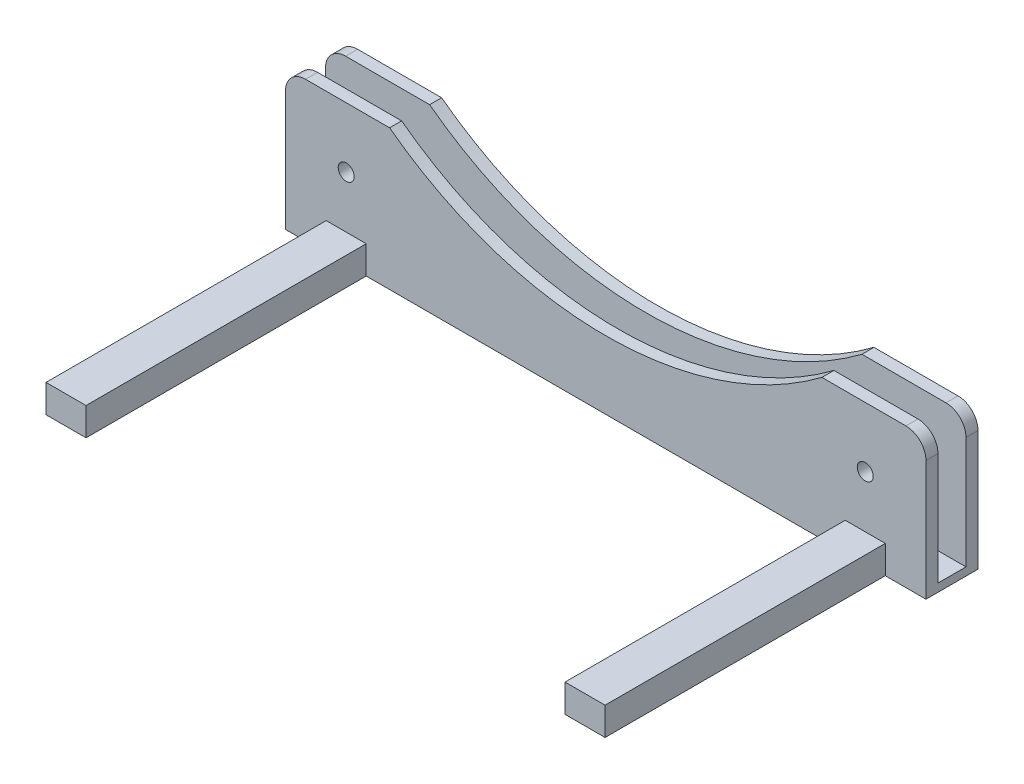
from build123d import *

# Parameters (mm, degrees)
SKETCH_1_R          = 2
EXTRUDE_1_DEPTH     = 13
SKETCH_2_W          = 7
SKETCH_2_H          = 34.84138361
CUT_EXTRUDE_1_DEPTH = 193.919672403
SKETCH_3_W          = 10
SKETCH_3_H          = 7
EXTRUDE_2_DEPTH     = 70


with BuildPart() as part:
    # 草图1 → 凸台-拉伸1 (new body)
    with BuildSketch(Plane.XY):
        with BuildLine():
            Line((54, -72), (75, -72))
            ThreePointArc((75, -72), (78.535533906, -73.464466094), (80, -77))
            Line((80, -77), (80, -107))
            Line((80, -107), (-80, -107))
            Line((-80, -107), (-80, -77))
            ThreePointArc((-80, -77), (-78.535533906, -73.464466094), (-75, -72))
            Line((-75, -72), (-54, -72))
            ThreePointArc((-54, -72), (0, -90), (54, -72))
        make_face()
        with Locations(Location((-64.83247643, -87, 0), (0, 0, 180))):
            Circle(SKETCH_1_R, mode=Mode.SUBTRACT)
        with Locations(Location((64.83247643, -87, 0), (0, 0, 180))):
            Circle(SKETCH_1_R, mode=Mode.SUBTRACT)
    extrude(amount=EXTRUDE_1_DEPTH)

    # 草图2 → 切除-拉伸1 (cut, through all)
    with BuildSketch(Plane(origin=(80, 0, 0), x_dir=(0, 0, -1), z_dir=(1, 0, 0))):
        with Locations((-6.5, -87.579308195)):
            Rectangle(SKETCH_2_W, SKETCH_2_H)
    extrude(amount=-CUT_EXTRUDE_1_DEPTH, mode=Mode.SUBTRACT)

    # 草图3 → 凸台-拉伸2 (add)
    with BuildSketch(Plane.XY.offset(13)):
        with Locations((-64.83247643, -103.5)):
            Rectangle(SKETCH_3_W, SKETCH_3_H)
        with Locations((64.83247643, -103.5)):
            Rectangle(SKETCH_3_W, SKETCH_3_H)
    extrude(amount=EXTRUDE_2_DEPTH)


solid = part.part
